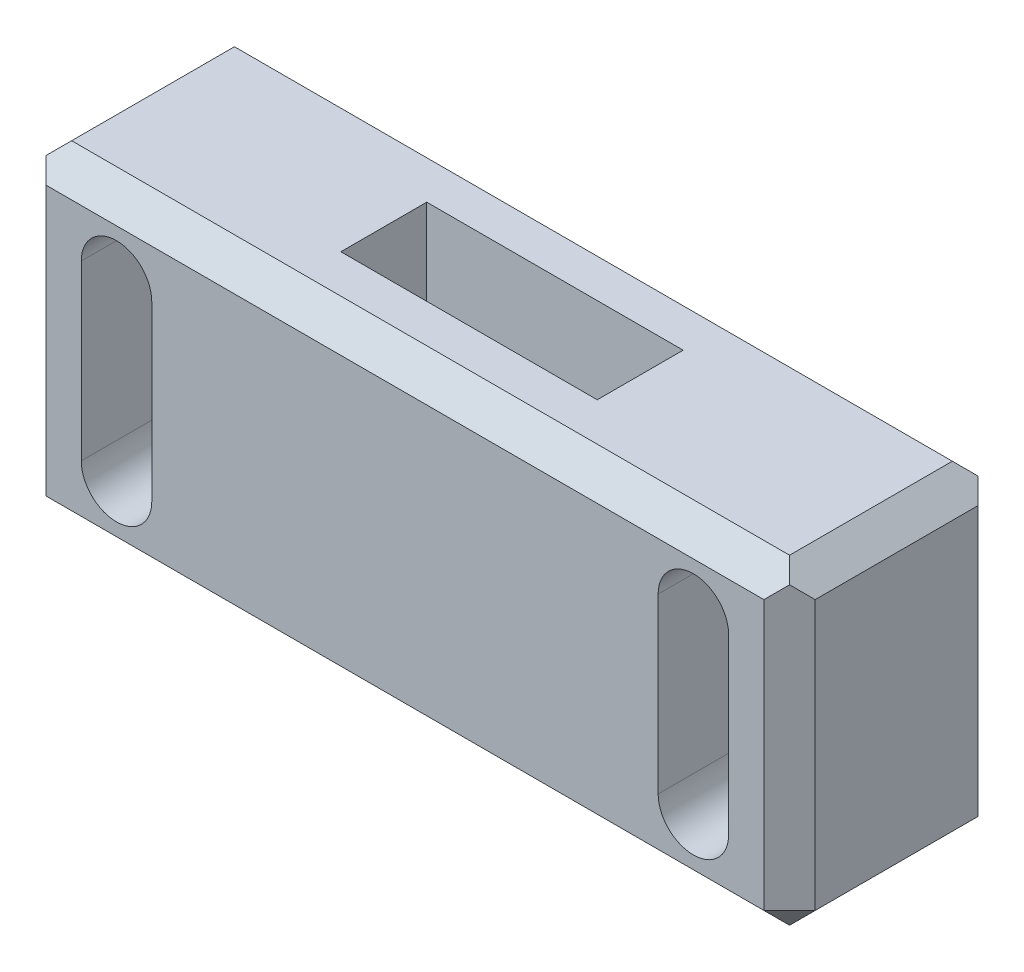
from build123d import *

# Parameters (mm, degrees)
SKETCH1_W           = 30
SKETCH1_H           = 16.7
SKETCH1_W_2         = 20
SKETCH1_H_2         = 6.7
BOSS_EXTRUDE1_DEPTH = 25
SKETCH1_3_W         = 20
SKETCH1_3_H         = 1
BOSS_EXTRUDE2_DEPTH = 13
SKETCH2_W           = 15
SKETCH2_H           = 25
BOSS_EXTRUDE3_DEPTH = 16.7
CHAMFER1_SIZE       = 2
CHAMFER2_SIZE       = 2


with BuildPart() as part:
    # Sketch1 → Boss-Extrude1 (new body)
    with BuildSketch(Plane(origin=(0, 0, 0), x_dir=(1, 0, 0), z_dir=(0, 1, 0))):
        with Locations((15, 8.35)):
            Rectangle(SKETCH1_W, SKETCH1_H)
        with Locations((15, 8.35)):
            Rectangle(SKETCH1_W_2, SKETCH1_H_2, mode=Mode.SUBTRACT)
    extrude(amount=BOSS_EXTRUDE1_DEPTH)

    # Sketch1<3> → Boss-Extrude2 (add)
    with BuildSketch(Plane(origin=(0, 0, 0), x_dir=(1, 0, 0), z_dir=(0, 1, 0))):
        with Locations((15, 11.2)):
            Rectangle(SKETCH1_3_W, SKETCH1_3_H)
        with Locations((15, 5.5)):
            Rectangle(SKETCH1_3_W, SKETCH1_3_H)
    extrude(amount=BOSS_EXTRUDE2_DEPTH)

    # Sketch2 → Boss-Extrude3 (add, through all)
    # profile 1 of 2: a face of its own
    with BuildSketch(Plane(origin=(0, 0, -16.7), x_dir=(-1, 0, 0), z_dir=(0, 0, -1))):
        with Locations((-37.5, 12.5)):
            Rectangle(SKETCH2_W, SKETCH2_H)
        with BuildLine():
            Line((-40.25, 5.75), (-40.25, 19.25))
            ThreePointArc((-40.25, 19.25), (-37.5, 22), (-34.75, 19.25))
            Line((-34.75, 19.25), (-34.75, 5.75))
            ThreePointArc((-34.75, 5.75), (-37.5, 3), (-40.25, 5.75))
        make_face(mode=Mode.SUBTRACT)
    # profile 2 of 2: a face of its own
    with BuildSketch(Plane(origin=(0, 0, -16.7), x_dir=(-1, 0, 0), z_dir=(0, 0, -1))):
        with Locations((7.5, 12.5)):
            Rectangle(SKETCH2_W, SKETCH2_H)
        with BuildLine():
            Line((10.25, 5.75), (10.25, 19.25))
            ThreePointArc((10.25, 19.25), (7.5, 22), (4.75, 19.25))
            Line((4.75, 19.25), (4.75, 5.75))
            ThreePointArc((4.75, 5.75), (7.5, 3), (10.25, 5.75))
        make_face(mode=Mode.SUBTRACT)
    extrude(amount=-BOSS_EXTRUDE3_DEPTH)

    # Chamfer1
    chamfer1_edges = [part.edges().sort_by_distance(p)[0] for p in [
        (15, 25, -16.7),
        (45, 25, -8.35),
        (-15, 25, -8.35),
        (15, 25, 0),
    ]]
    chamfer(chamfer1_edges, length=CHAMFER1_SIZE)

    # Chamfer2
    chamfer2_edges = [part.edges().sort_by_distance(p)[0] for p in [
        (45, 11.5, -16.7),
        (45, 11.5, 0),
        (15, 0, -16.7),
        (15, 0, 0),
        (25, 0, -8.35),
        (5, 0, -8.35),
        (15, 0, -10.7),
        (15, 0, -6),
        (45, 0, -8.35),
        (-15, 11.5, 0),
        (-15, 0, -8.35),
        (-15, 11.5, -16.7),
    ]]
    chamfer(chamfer2_edges, length=CHAMFER2_SIZE)


solid = part.part
